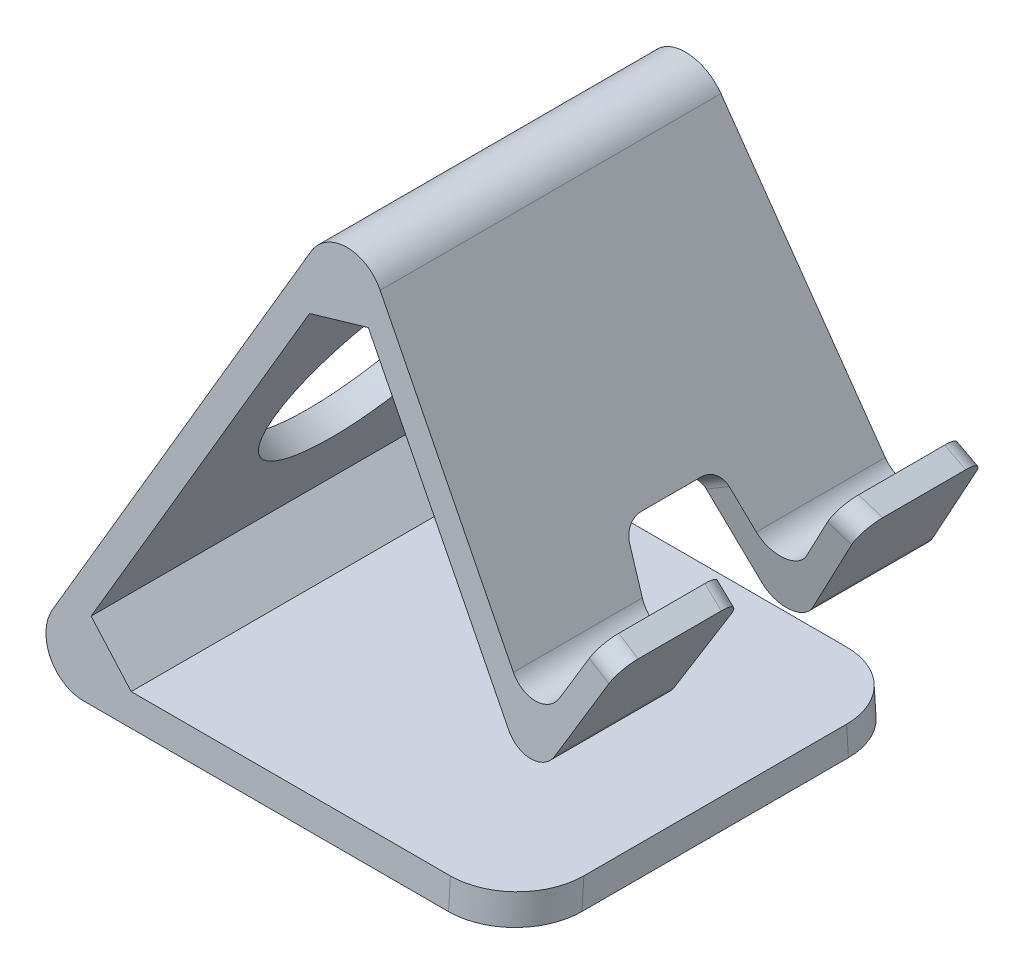
from build123d import *
from OCP.BRepFilletAPI import BRepFilletAPI_MakeChamfer

# Parameters (mm, degrees)
EXTRUDE_1_DEPTH                 = 30
CUT_EXTRUDE_1_DEPTH             = 114.688170009
CUT_EXTRUDE_1_DEPTH_BACK        = 114.688170009
CUT_EXTRUDE_2_REACH             = 87.147
CUT_EXTRUDE_2_DIRECTION_2_DEPTH = 86.146653668
FILLET_1_R                      = 10
CHAMFER_1_SIZE                  = 10
CHAMFER_1_SIZE2                 = 7.328994571
CHAMFER_1_SIZE2_2               = 7.3430239
FILLET_2_R                      = 6
FILLET_3_R                      = 4
FILLET_4_R                      = 3
SKETCH_5_R                      = 5
EXTRUDE_2_DEPTH                 = 1
CUT_EXTRUDE_3_REACH             = 120.862
SKETCH_6_R                      = 17.5
CUT_EXTRUDE_4_DEPTH             = 1
FILLET_5_R                      = 3


with BuildPart() as part:
    # 草图1 → 凸台-拉伸1 (new, symmetric)
    with BuildSketch(Plane.XY):
        Polygon((75, 0), (75, 4.5), (7.120639938, 4.5), (45.106425199, 72.030284909), (75.873796317, 20.597074957), (88.0081468, 41.61438651), (84.977057886, 43.36438651), (76.106425199, 28), (45, 80), (0, 0), align=None)
    extrude(amount=EXTRUDE_1_DEPTH, both=True)

    # 草图2 → 切除-拉伸1 (cut, two sides: drawn at the far end of the back side and taken through both)
    with BuildSketch(Plane(origin=(75, 0, 0), x_dir=(0, 0, -1), z_dir=(1, 0, 0)).offset(-CUT_EXTRUDE_1_DEPTH_BACK)):
        Polygon((-30, 0), (-30, 80), (-25, 80), align=None)
        Polygon((25, 80), (30, 0), (30, 80), align=None)
    extrude(amount=CUT_EXTRUDE_1_DEPTH + CUT_EXTRUDE_1_DEPTH_BACK, mode=Mode.SUBTRACT)

    # 草图4 → 切除-拉伸2 (cut, up to next)
    with BuildSketch(Plane(origin=(68.384918365, 40.907891305, 0), x_dir=(0, 0, -1), z_dir=(0.8581734811109418, 0.5133597922684714, 0)), mode=Mode.PRIVATE) as cut_extrude_2_sk1:
        Polygon((7, 0), (-7, 0), (-12, -26.635610966), (12, -26.635610966), align=None)
    cut_extrude_2_tool1 = extrude(cut_extrude_2_sk1.sketch, amount=-CUT_EXTRUDE_2_REACH, mode=Mode.PRIVATE) & part.part
    add(cut_extrude_2_tool1.solids().sort_by_distance((75.821466, 28.476361, 0))[0], mode=Mode.SUBTRACT)

    # 草图4 → 切除-拉伸2 direction 2 (cut)
    with BuildSketch(Plane(origin=(68.384918365, 40.907891305, 0), x_dir=(0, 0, -1), z_dir=(0.8581734811109418, 0.5133597922684714, 0))):
        Polygon((7, 0), (-7, 0), (-12, -26.635610966), (12, -26.635610966), align=None)
    extrude(amount=CUT_EXTRUDE_2_DIRECTION_2_DEPTH, mode=Mode.SUBTRACT)

    # 圆角1
    fillet_1_edges = [part.edges().sort_by_distance(p)[0] for p in [
        (75, 2.25, 29.859375),
        (75, 2.25, -29.859375),
    ]]
    fillet(fillet_1_edges, radius=FILLET_1_R)

    # 倒角1: one chamfer whose edges measure the first distance from different faces: ONE call of the kernel's chamfer builder (chamfer() names one face for all edges)
    chamfer_1_edges_1 = [part.edges().sort_by_distance(p)[0] for p in [
        (45.106425199, 72.030284909, 0),
    ]]
    chamfer_1_side_1 = [part.faces().sort_by_distance(p)[0] for p in [
        (25.629609, 37.404833889, 0),
    ]]
    chamfer_1_edges_2 = [part.edges().sort_by_distance(p)[0] for p in [
        (7.120639938, 4.5, 0),
    ]]
    chamfer_1_side_2 = [part.faces().sort_by_distance(p)[0] for p in [
        (40.718728401, 4.5, 0),
    ]]
    chamfer_1 = BRepFilletAPI_MakeChamfer(part.part.solid().wrapped)
    for e in chamfer_1_edges_1:
        chamfer_1.Add(CHAMFER_1_SIZE, CHAMFER_1_SIZE2, e.wrapped, chamfer_1_side_1[0].wrapped)  # the first distance lies on this face
    for e in chamfer_1_edges_2:
        chamfer_1.Add(CHAMFER_1_SIZE, CHAMFER_1_SIZE2_2, e.wrapped, chamfer_1_side_2[0].wrapped)  # the first distance lies on this face
    add(Compound.cast(chamfer_1.Shape()), mode=Mode.REPLACE)

    # 圆角2
    fillet_2_edges = [part.edges().sort_by_distance(p)[0] for p in [
        (0, 0, 0),
        (45, 80, 0),
    ]]
    fillet(fillet_2_edges, radius=FILLET_2_R)

    # 圆角3
    fillet_3_edges = [part.edges().sort_by_distance(p)[0] for p in [
        (76.106425199, 28, -19.036749216),
        (75.873796317, 20.597074957, -19.853169341),
        (76.106425199, 28, 19.036749216),
        (75.873796317, 20.597074957, 19.853169341),
    ]]
    fillet(fillet_3_edges, radius=FILLET_3_R)

    # 圆角4
    fillet_4_edges = [part.edges().sort_by_distance(p)[0] for p in [
        (86.492602343, 42.48938651, 8.490215421),
        (86.492602343, 42.48938651, -8.490215421),
        (86.492602343, 42.48938651, 27.344413343),
        (86.492602343, 42.48938651, -27.344413343),
    ]]
    fillet(fillet_4_edges, radius=FILLET_4_R)

    # 草图5 → 凸台-拉伸2 (add, symmetric)
    with BuildSketch(Plane.XZ):
        with Locations(Location((65, 19.980487786, 0), (0, 0, 90))):
            Circle(SKETCH_5_R)
        with Locations(Location((65, -19.980487786, 0), (0, 0, 90))):
            Circle(SKETCH_5_R)
        with BuildLine():
            Line((26.526731338, 10), (26.526731338, -10))
            ThreePointArc((26.526731338, -10), (21.526731338, -15), (16.526731338, -10))
            Line((16.526731338, -10), (16.526731338, 10))
            ThreePointArc((16.526731338, 10), (21.526731338, 15), (26.526731338, 10))
        make_face()
    extrude(amount=EXTRUDE_2_DEPTH, both=True)

    # 草图6 → 切除-拉伸3 (cut, up to next)
    with BuildSketch(Plane(origin=(0, 0, 0), x_dir=(0, 0, 1), z_dir=(-0.8715755371245493, 0.49026123963255896, 0)), mode=Mode.PRIVATE) as cut_extrude_3_sk1:
        with Locations(Location((0, 45.852917409, 0), (0, 0, 270))):
            Circle(SKETCH_6_R)
    cut_extrude_3_tool1 = extrude(cut_extrude_3_sk1.sketch, amount=-CUT_EXTRUDE_3_REACH, mode=Mode.PRIVATE) & part.part
    add(cut_extrude_3_tool1.solids().sort_by_distance((22.479908, 39.964281, 0))[0], mode=Mode.SUBTRACT)

    # 草图7 → 切除-拉伸4 (cut)
    # profile 1 of 10: a face of its own
    with BuildSketch(Plane(origin=(0, 0, 0), x_dir=(0, 0, 1), z_dir=(-0.8715755371245493, 0.49026123963255896, 0))):
        with BuildLine():
            Line((-19.399104661, 19.775119977), (-19.399104661, 18.150683932))
            Line((-19.399104661, 18.150683932), (-19.975517451, 18.150683932))
            Line((-19.975517451, 18.150683932), (-19.975517451, 22.447579277))
            Line((-19.975517451, 22.447579277), (-18.76046549, 22.447579277))
            add(Edge.make_bspline(
                [(-18.76046549, 22.447579277), (-18.704203936, 22.446766241), (-18.594998956, 22.445188118), (-18.435998347, 22.429256883), (-18.286691614, 22.403551023), (-18.147030472, 22.366614071), (-18.016690831, 22.319958484), (-17.895849834, 22.26301983), (-17.785484452, 22.194124399), (-17.684256691, 22.116821146), (-17.594608587, 22.028592131), (-17.516356648, 21.931316221), (-17.449321218, 21.825351703), (-17.39625758, 21.709400996), (-17.354408635, 21.585060226), (-17.324241682, 21.451780839), (-17.305942193, 21.309457), (-17.304036753, 21.211568417), (-17.303058151, 21.161294485)],
                knots=[0, 0, 0, 0, 1.221496758, 2.370953492, 3.466229561, 4.50853695, 5.504092727, 6.469115662, 7.403359976, 8.324520871, 9.229832985, 10.127722387, 11.030547589, 11.94541344, 12.890072117, 13.874984866, 14.908627926, 16, 16, 16, 16], degree=3))
            add(Edge.make_bspline(
                [(-17.303058151, 21.161294485), (-17.304120558, 21.110174875), (-17.306209655, 21.009654281), (-17.328442873, 20.862992252), (-17.36240952, 20.723429523), (-17.411036427, 20.591577203), (-17.473609659, 20.467123931), (-17.550133863, 20.35050613), (-17.640478876, 20.241252227), (-17.743707964, 20.140885771), (-17.857321945, 20.050247341), (-17.978460752, 19.971121857), (-18.107302586, 19.90638456), (-18.242417147, 19.853712521), (-18.384562278, 19.81304358), (-18.534213736, 19.787800271), (-18.690296428, 19.772997412), (-18.796459448, 19.774403721), (-18.850529988, 19.775119977)],
                knots=[0, 0, 0, 0, 1.047567089, 2.059915297, 3.034553849, 3.988992129, 4.935123622, 5.885153844, 6.843260912, 7.836680967, 8.832258631, 9.819590091, 10.798269876, 11.783568742, 12.78991175, 13.824162436, 14.891810808, 16, 16, 16, 16], degree=3))
            Line((-18.850529988, 19.775119977), (-19.399104661, 19.775119977))
        make_face()
        with BuildLine():
            Line((-19.399104661, 21.975968813), (-19.399104661, 20.246730442))
            Line((-19.399104661, 20.246730442), (-18.895562237, 20.246730442))
            add(Edge.make_bspline(
                [(-18.895562237, 20.246730442), (-18.855132758, 20.247141877), (-18.776825856, 20.247938777), (-18.6631213, 20.260278049), (-18.556724388, 20.277387485), (-18.458002942, 20.303203276), (-18.366240149, 20.334562125), (-18.282732286, 20.374909649), (-18.206359526, 20.422014914), (-18.137509708, 20.475932545), (-18.076350352, 20.53687963), (-18.02374363, 20.604808505), (-17.978315729, 20.678384591), (-17.942471937, 20.75902707), (-17.913361405, 20.844951512), (-17.894417897, 20.9376675), (-17.881559748, 21.036207765), (-17.880180436, 21.104209033), (-17.879470941, 21.139187745)],
                knots=[0, 0, 0, 0, 1.257807907, 2.436218341, 3.556349562, 4.609289964, 5.608814519, 6.570169625, 7.489619625, 8.397178748, 9.286258589, 10.169964329, 11.066038699, 11.970929755, 12.911220345, 13.884328166, 14.911733895, 16, 16, 16, 16], degree=3))
            add(Edge.make_bspline(
                [(-17.879470941, 21.139187745), (-17.880366407, 21.17305432), (-17.882104127, 21.238774976), (-17.892340429, 21.333965502), (-17.911136731, 21.422659033), (-17.938465078, 21.504432389), (-17.971597318, 21.580804996), (-18.013959479, 21.649587853), (-18.062411007, 21.71285808), (-18.119236744, 21.768700183), (-18.184210581, 21.817443536), (-18.256259665, 21.859768468), (-18.335734821, 21.896209257), (-18.422812258, 21.92535288), (-18.517335273, 21.94819436), (-18.619184995, 21.964293723), (-18.72860716, 21.974266959), (-18.804110594, 21.975388665), (-18.843161075, 21.975968813)],
                knots=[0, 0, 0, 0, 1.111901111, 2.157728374, 3.138310241, 4.081801531, 4.984240268, 5.864706733, 6.726745576, 7.594723825, 8.470986253, 9.386802377, 10.332970003, 11.335972228, 12.39643462, 13.521791194, 14.718266964, 16, 16, 16, 16], degree=3))
            Line((-18.843161075, 21.975968813), (-19.399104661, 21.975968813))
        make_face(mode=Mode.SUBTRACT)
    # profile 2 of 10: a face of its own
    with BuildSketch(Plane(origin=(0, 0, 0), x_dir=(0, 0, 1), z_dir=(-0.8715755371245493, 0.49026123963255896, 0))):
        Polygon((-13.215767457, 18.150683932), (-13.792180247, 18.150683932), (-13.792180247, 20.089526954), (-15.94062792, 20.089526954), (-15.94062792, 18.150683932), (-16.51704071, 18.150683932), (-16.51704071, 22.447579277), (-15.94062792, 22.447579277), (-15.94062792, 20.561137418), (-13.792180247, 20.561137418), (-13.792180247, 22.447579277), (-13.215767457, 22.447579277), align=None)
    # profile 3 of 10: a face of its own
    with BuildSketch(Plane(origin=(0, 0, 0), x_dir=(0, 0, 1), z_dir=(-0.8715755371245493, 0.49026123963255896, 0))):
        with BuildLine():
            add(Edge.make_bspline(
                [(-12.429750016, 20.248367978), (-12.428039367, 20.332224132), (-12.424704031, 20.495722617), (-12.398187382, 20.734568876), (-12.354154886, 20.960256252), (-12.293186759, 21.173261776), (-12.213488359, 21.372793841), (-12.11530494, 21.558790611), (-12.000681773, 21.732368636), (-11.86839789, 21.891329956), (-11.721713702, 22.034973246), (-11.55984656, 22.158661191), (-11.387139048, 22.265715866), (-11.200874213, 22.351714248), (-11.001998936, 22.418238833), (-10.790977685, 22.465123599), (-10.567606701, 22.494564057), (-10.414582828, 22.498145163), (-10.33615981, 22.49998044)],
                knots=[0, 0, 0, 0, 1.158510879, 2.258805906, 3.315699711, 4.332576337, 5.315797817, 6.279028103, 7.233983928, 8.184730643, 9.131489913, 10.064570513, 10.994016395, 11.933809892, 12.892637502, 13.886219116, 14.916711014, 16, 16, 16, 16], degree=3))
            add(Edge.make_bspline(
                [(-10.33615981, 22.49998044), (-10.262911862, 22.498493374), (-10.119645332, 22.495584803), (-9.910518153, 22.465706859), (-9.712445297, 22.419492616), (-9.524802509, 22.354868203), (-9.348950118, 22.269651187), (-9.183202081, 22.167136441), (-9.029210051, 22.044739227), (-8.887479401, 21.904971113), (-8.759080839, 21.750748931), (-8.647402153, 21.583770318), (-8.552576703, 21.405828482), (-8.475500186, 21.216469637), (-8.415583943, 21.015726154), (-8.37375014, 20.803510192), (-8.346451986, 20.580407711), (-8.343808023, 20.427761151), (-8.342459322, 20.349895231)],
                knots=[0, 0, 0, 0, 1.065070709, 2.083184418, 3.066549119, 4.02094667, 4.96400148, 5.903882633, 6.850841688, 7.819562541, 8.795200571, 9.765450196, 10.737128834, 11.723743066, 12.735050836, 13.780118611, 14.867625272, 16, 16, 16, 16], degree=3))
            add(Edge.make_bspline(
                [(-8.342459322, 20.349895231), (-8.344154055, 20.265761905), (-8.347464073, 20.101439402), (-8.374267317, 19.861623758), (-8.416850382, 19.634874715), (-8.478405454, 19.421511198), (-8.55784676, 19.221793424), (-8.655007993, 19.035526302), (-8.769316447, 18.862340467), (-8.901008014, 18.703827122), (-9.047398412, 18.56148807), (-9.20600935, 18.436886887), (-9.376963681, 18.33206282), (-9.560096965, 18.246799452), (-9.75476524, 18.179259824), (-9.961482992, 18.132082764), (-10.179818826, 18.104005507), (-10.329252412, 18.100220505), (-10.405755105, 18.098282769)],
                knots=[0, 0, 0, 0, 1.170824374, 2.286760772, 3.354429575, 4.378781923, 5.372758946, 6.341306435, 7.298017473, 8.255753746, 9.204101261, 10.135039238, 11.05763034, 11.988955804, 12.941676056, 13.920340457, 14.935315948, 16, 16, 16, 16], degree=3))
            add(Edge.make_bspline(
                [(-10.405755105, 18.098282769), (-10.480376127, 18.099733433), (-10.626377012, 18.102571752), (-10.839370929, 18.132976764), (-11.041821903, 18.177202224), (-11.23209439, 18.244036182), (-11.411998645, 18.326822163), (-11.578623219, 18.43171043), (-11.735827804, 18.552227577), (-11.878949566, 18.692260534), (-12.008041044, 18.84694616), (-12.121900507, 19.013508585), (-12.216875354, 19.192284648), (-12.295156526, 19.381720754), (-12.355654798, 19.582522935), (-12.399016275, 19.794588548), (-12.424378689, 20.01795013), (-12.427935286, 20.170520158), (-12.429750016, 20.248367978)],
                knots=[0, 0, 0, 0, 1.076574679, 2.106388418, 3.10050034, 4.063748489, 5.012109131, 5.953543952, 6.900110232, 7.867026378, 8.837692636, 9.804897769, 10.774443719, 11.754976828, 12.759652806, 13.797478677, 14.876178449, 16, 16, 16, 16], degree=3))
        make_face()
        with BuildLine():
            add(Edge.make_bspline(
                [(-11.853337225, 20.295037764), (-11.852092768, 20.231395088), (-11.849662269, 20.107097186), (-11.830340842, 19.925677642), (-11.800027824, 19.75374943), (-11.754975102, 19.591958543), (-11.700520119, 19.438657907), (-11.629541973, 19.296651115), (-11.548892701, 19.162840036), (-11.454614231, 19.040705457), (-11.351139156, 18.929914316), (-11.238405636, 18.8337049), (-11.118089278, 18.751691531), (-10.989810179, 18.68542752), (-10.854257752, 18.633125458), (-10.711074675, 18.596656731), (-10.560142497, 18.573855564), (-10.456874841, 18.571233031), (-10.404117568, 18.569893234)],
                knots=[0, 0, 0, 0, 1.20602457, 2.355437185, 3.454324103, 4.511001866, 5.535469377, 6.532588819, 7.514714146, 8.492470201, 9.451281297, 10.383258467, 11.295780282, 12.205070569, 13.113889858, 14.043610299, 15.000521651, 16, 16, 16, 16], degree=3))
            add(Edge.make_bspline(
                [(-10.404117568, 18.569893234), (-10.347826274, 18.571302391), (-10.2378292, 18.574055979), (-10.077675562, 18.595685908), (-9.926769538, 18.630773009), (-9.784844937, 18.679847147), (-9.652434978, 18.743970934), (-9.529481664, 18.822469761), (-9.415872784, 18.914597246), (-9.312400946, 19.020739642), (-9.219980039, 19.139876387), (-9.138573365, 19.270253842), (-9.07046548, 19.412364975), (-9.014783003, 19.565431325), (-8.971619461, 19.729915767), (-8.94057712, 19.905682841), (-8.922861831, 20.092710718), (-8.920224592, 20.22103854), (-8.918872112, 20.286850082)],
                knots=[0, 0, 0, 0, 1.050238148, 2.052237813, 3.009712863, 3.937548075, 4.848751615, 5.74879752, 6.654045465, 7.572508576, 8.508832851, 9.462833466, 10.435563278, 11.444259228, 12.49809764, 13.605132832, 14.771818164, 16, 16, 16, 16], degree=3))
            add(Edge.make_bspline(
                [(-8.918872112, 20.286850082), (-8.919755967, 20.354311955), (-8.921477296, 20.485695583), (-8.941065612, 20.676886065), (-8.970914466, 20.856419228), (-9.011937217, 21.02448404), (-9.067423803, 21.179861948), (-9.133292787, 21.324060086), (-9.212506054, 21.456054527), (-9.303367016, 21.575789478), (-9.404804762, 21.682279655), (-9.515793387, 21.775089053), (-9.63559145, 21.854161668), (-9.764929602, 21.918181322), (-9.903182105, 21.96767729), (-10.050116684, 22.002371931), (-10.206138847, 22.024292639), (-10.313159031, 22.026986985), (-10.368091769, 22.028369975)],
                knots=[0, 0, 0, 0, 1.261178879, 2.456176373, 3.589779302, 4.66302718, 5.686490866, 6.670717547, 7.623063715, 8.559146006, 9.476095161, 10.367459636, 11.259291589, 12.154054306, 13.059755282, 13.99935134, 14.973080545, 16, 16, 16, 16], degree=3))
            add(Edge.make_bspline(
                [(-10.368091769, 22.028369975), (-10.422223855, 22.027119591), (-10.528267414, 22.024670115), (-10.682870896, 22.000613981), (-10.82996626, 21.964299631), (-10.969192698, 21.911767781), (-11.099881365, 21.842831686), (-11.223852411, 21.760894133), (-11.338758769, 21.662529876), (-11.444848232, 21.550286283), (-11.54111641, 21.426512948), (-11.624971467, 21.292324367), (-11.695892561, 21.148937103), (-11.752905886, 20.995932544), (-11.797990566, 20.833763765), (-11.830823938, 20.662412675), (-11.849494183, 20.481587786), (-11.852037582, 20.358125409), (-11.853337225, 20.295037764)],
                knots=[0, 0, 0, 0, 1.012527091, 1.983518156, 2.921439044, 3.844608478, 4.760868639, 5.681816309, 6.620460344, 7.585263555, 8.568274607, 9.550555325, 10.542077912, 11.557320507, 12.602180184, 13.689234584, 14.819229379, 16, 16, 16, 16], degree=3))
        make_face(mode=Mode.SUBTRACT)
    # profile 4 of 10: a face of its own
    with BuildSketch(Plane(origin=(0, 0, 0), x_dir=(0, 0, 1), z_dir=(-0.8715755371245493, 0.49026123963255896, 0))):
        with BuildLine():
            Line((-3.993162814, 18.150683932), (-4.676834234, 18.150683932))
            Line((-4.676834234, 18.150683932), (-6.784343498, 21.486345448))
            add(Edge.make_bspline(
                [(-6.784343498, 21.486345448), (-6.812236517, 21.532703424), (-6.866425524, 21.622765121), (-6.907631931, 21.719447608), (-6.927627927, 21.766364162)],
                knots=[0, 0, 0, 0, 1.029471514, 2, 2, 2, 2], degree=3))
            Line((-6.927627927, 21.766364162), (-6.944822059, 21.766364162))
            add(Edge.make_bspline(
                [(-6.944822059, 21.766364162), (-6.943347309, 21.752727174), (-6.940049162, 21.72222926), (-6.937318376, 21.671391663), (-6.933760495, 21.611104316), (-6.931426306, 21.540943287), (-6.930084772, 21.460963991), (-6.928183577, 21.371179572), (-6.927465397, 21.271556307), (-6.927571941, 21.201959941), (-6.927627927, 21.165388326)],
                knots=[0, 0, 0, 0, 0.547243266, 1.223861017, 2.030938069, 2.957211031, 4.024706972, 5.222865249, 6.540666563, 8, 8, 8, 8], degree=3))
            Line((-6.927627927, 21.165388326), (-6.927627927, 18.150683932))
            Line((-6.927627927, 18.150683932), (-7.504040718, 18.150683932))
            Line((-7.504040718, 18.150683932), (-7.504040718, 22.447579277))
            Line((-7.504040718, 22.447579277), (-6.770424439, 22.447579277))
            Line((-6.770424439, 22.447579277), (-4.725960324, 19.179875519))
            add(Edge.make_bspline(
                [(-4.725960324, 19.179875519), (-4.714525608, 19.161299341), (-4.692808881, 19.126019601), (-4.661608186, 19.07629842), (-4.634223464, 19.031590447), (-4.61079959, 18.991984226), (-4.591038858, 18.957649466), (-4.575359045, 18.928632448), (-4.562916766, 18.904958855), (-4.556162032, 18.890597378), (-4.553200241, 18.884300211)],
                knots=[0, 0, 0, 0, 1.528350138, 2.902631225, 4.112788085, 5.201585076, 6.126599139, 6.888137874, 7.512474782, 8, 8, 8, 8], degree=3))
            Line((-4.553200241, 18.884300211), (-4.541737486, 18.884300211))
            add(Edge.make_bspline(
                [(-4.541737486, 18.884300211), (-4.544043307, 18.900661122), (-4.54906686, 18.936305658), (-4.55434236, 18.993965084), (-4.559637465, 19.059988561), (-4.562173081, 19.134028932), (-4.565803573, 19.216151322), (-4.568385371, 19.306223107), (-4.568674549, 19.404492179), (-4.569267349, 19.472722089), (-4.569575604, 19.508201555)],
                knots=[0, 0, 0, 0, 0.634399717, 1.382128569, 2.222929659, 3.177583211, 4.226479155, 5.379771441, 6.637484509, 8, 8, 8, 8], degree=3))
            Line((-4.569575604, 19.508201555), (-4.569575604, 22.447579277))
            Line((-4.569575604, 22.447579277), (-3.993162814, 22.447579277))
            Line((-3.993162814, 22.447579277), (-3.993162814, 18.150683932))
        make_face()
    # profile 5 of 10: a face of its own
    with BuildSketch(Plane(origin=(0, 0, 0), x_dir=(0, 0, 1), z_dir=(-0.8715755371245493, 0.49026123963255896, 0))):
        Polygon((-0.639488398, 18.150683932), (-2.945139559, 18.150683932), (-2.945139559, 22.447579277), (-0.744290724, 22.447579277), (-0.744290724, 21.975968813), (-2.368726769, 21.975968813), (-2.368726769, 20.561137418), (-0.849093049, 20.561137418), (-0.849093049, 20.089526954), (-2.368726769, 20.089526954), (-2.368726769, 18.622294397), (-0.639488398, 18.622294397), align=None)
    # profile 6 of 10: a face of its own
    with BuildSketch(Plane(origin=(0, 0, 0), x_dir=(0, 0, 1), z_dir=(-0.8715755371245493, 0.49026123963255896, 0))):
        with BuildLine():
            add(Edge.make_bspline(
                [(1.666162763, 18.949801664), (1.701074457, 18.922511731), (1.77323226, 18.86610709), (1.897093387, 18.794476642), (2.036742904, 18.730052923), (2.189694068, 18.674250891), (2.348328669, 18.628176167), (2.506628999, 18.59565402), (2.660347413, 18.573637046), (2.761876159, 18.571124324), (2.81161943, 18.569893234)],
                knots=[0, 0, 0, 0, 0.865539583, 1.788954577, 2.789281186, 3.869785964, 4.969270071, 6.015824901, 7.027867855, 8, 8, 8, 8], degree=3))
            add(Edge.make_bspline(
                [(2.81161943, 18.569893234), (2.847928003, 18.570357607), (2.918168595, 18.571255957), (3.020207572, 18.578352404), (3.114973385, 18.591722039), (3.202894178, 18.608493833), (3.283862162, 18.6304015), (3.357747907, 18.658398168), (3.425144667, 18.69088262), (3.485451723, 18.728601055), (3.53836402, 18.771653813), (3.584654773, 18.819196698), (3.623507216, 18.872092814), (3.654958031, 18.930303723), (3.679181707, 18.993425466), (3.697567621, 19.06137814), (3.708210121, 19.134504756), (3.709265673, 19.185026261), (3.70980811, 19.21098871)],
                knots=[0, 0, 0, 0, 1.387952524, 2.685057481, 3.906752822, 5.044389127, 6.104925896, 7.10867273, 8.060544729, 8.960756871, 9.821090645, 10.662232403, 11.49066096, 12.321647717, 13.183814073, 14.069581906, 15.007979264, 16, 16, 16, 16], degree=3))
            add(Edge.make_bspline(
                [(3.70980811, 19.21098871), (3.708827838, 19.240293384), (3.706902586, 19.297847705), (3.688014227, 19.381763187), (3.657820532, 19.461203421), (3.614147475, 19.53506718), (3.561218366, 19.605203822), (3.499000748, 19.67115321), (3.427811573, 19.733268657), (3.360381521, 19.780871106), (3.298520829, 19.819511395), (3.242883947, 19.853375807), (3.17754975, 19.88959408), (3.10336252, 19.930079582), (3.019795166, 19.974207941), (2.926977097, 20.022201189), (2.824903174, 20.07406212), (2.753785057, 20.109500642), (2.716642322, 20.128009058)],
                knots=[0, 0, 0, 0, 0.982941607, 1.930495303, 2.873604538, 3.826420128, 4.801766699, 5.819939166, 6.86595615, 7.96993426, 8.587927195, 9.315806065, 10.157204154, 11.096563792, 12.154522406, 13.331194997, 14.606167838, 16, 16, 16, 16], degree=3))
            add(Edge.make_bspline(
                [(2.716642322, 20.128009058), (2.665160181, 20.154153506), (2.566073096, 20.204473426), (2.425972026, 20.282299411), (2.299664012, 20.358282104), (2.186791229, 20.432722444), (2.087742452, 20.506452241), (2.001306739, 20.577739649), (1.929525084, 20.648655147), (1.86979805, 20.718201644), (1.822050243, 20.789704014), (1.779594877, 20.861759374), (1.744760333, 20.937066398), (1.715764725, 21.014456915), (1.693551044, 21.094182542), (1.678351803, 21.176409298), (1.667930608, 21.260919326), (1.666756482, 21.318193191), (1.666162763, 21.34715486)],
                knots=[0, 0, 0, 0, 1.619222821, 3.116499544, 4.493497657, 5.752362701, 6.906613858, 7.955228956, 8.891569654, 9.733419001, 10.521050387, 11.299554277, 12.076853168, 12.844596608, 13.615272338, 14.394378029, 15.188085306, 16, 16, 16, 16], degree=3))
            add(Edge.make_bspline(
                [(1.666162763, 21.34715486), (1.667269368, 21.390368614), (1.669432778, 21.474851359), (1.690831381, 21.597889075), (1.724056736, 21.714403045), (1.771929232, 21.823851351), (1.833207543, 21.926296735), (1.907598977, 22.022057834), (1.995762019, 22.110951459), (2.097414007, 22.1910002), (2.208293819, 22.263823259), (2.327627502, 22.326505192), (2.453139052, 22.381397937), (2.586466952, 22.42395282), (2.726042072, 22.459156185), (2.873259674, 22.481931419), (3.027171626, 22.497377214), (3.132263411, 22.499101898), (3.185796482, 22.49998044)],
                knots=[0, 0, 0, 0, 0.970444009, 1.897214754, 2.797959901, 3.688009903, 4.573800912, 5.474420727, 6.406999593, 7.380328003, 8.377337185, 9.384428898, 10.406559165, 11.452128656, 12.526295673, 13.638633029, 14.797135032, 16, 16, 16, 16], degree=3))
            add(Edge.make_bspline(
                [(3.185796482, 22.49998044), (3.237659414, 22.499781618), (3.337599116, 22.499398487), (3.482279918, 22.49324214), (3.616420959, 22.484859129), (3.73981915, 22.471579004), (3.852536881, 22.455820873), (3.954311184, 22.434909112), (4.046156926, 22.41247297), (4.102419745, 22.391834464), (4.129017412, 22.382077824)],
                knots=[0, 0, 0, 0, 1.302853371, 2.510594277, 3.637626783, 4.678791113, 5.628121996, 6.495466126, 7.288747155, 8, 8, 8, 8], degree=3))
            Line((4.129017412, 22.382077824), (4.129017412, 21.753263871))
            add(Edge.make_bspline(
                [(4.129017412, 21.753263871), (4.095875707, 21.775542927), (4.029070665, 21.820451699), (3.920239505, 21.875086162), (3.80616652, 21.923325944), (3.685124407, 21.961366904), (3.557981338, 21.992004917), (3.424314908, 22.012611409), (3.284339704, 22.026430807), (3.188833902, 22.027713419), (3.139945465, 22.028369975)],
                knots=[0, 0, 0, 0, 0.918063685, 1.850577229, 2.796465716, 3.76568756, 4.766461771, 5.803068333, 6.875413303, 8, 8, 8, 8], degree=3))
            add(Edge.make_bspline(
                [(3.139945465, 22.028369975), (3.107716526, 22.028023238), (3.044513673, 22.027343266), (2.95194792, 22.018331788), (2.863705352, 22.006952622), (2.780214453, 21.988713591), (2.701505517, 21.964821354), (2.626919464, 21.936396913), (2.557083907, 21.902701106), (2.492318691, 21.864601568), (2.434118385, 21.821225028), (2.382886416, 21.77355746), (2.339365663, 21.721936338), (2.303179695, 21.666371946), (2.276617675, 21.606156587), (2.256332098, 21.542304324), (2.245095993, 21.474185405), (2.243425358, 21.427431991), (2.242575553, 21.403649863)],
                knots=[0, 0, 0, 0, 1.262873919, 2.476570353, 3.643139105, 4.749062229, 5.821993494, 6.865119038, 7.874788035, 8.858269162, 9.806190946, 10.714523887, 11.595346505, 12.447099743, 13.304211657, 14.16711336, 15.067662888, 16, 16, 16, 16], degree=3))
            add(Edge.make_bspline(
                [(2.242575553, 21.403649863), (2.242936062, 21.382328453), (2.243641446, 21.340610259), (2.252454268, 21.279579156), (2.264921451, 21.221505062), (2.284162004, 21.166633327), (2.309017052, 21.115017342), (2.338110731, 21.065841621), (2.373259134, 21.020204382), (2.41446737, 20.976363213), (2.465564989, 20.933061662), (2.527249587, 20.886622845), (2.600778597, 20.835542216), (2.688439022, 20.783219539), (2.78696471, 20.724661742), (2.898790203, 20.663759311), (3.022330486, 20.597788763), (3.109803436, 20.55435364), (3.15550206, 20.531661764)],
                knots=[0, 0, 0, 0, 0.763187322, 1.493278232, 2.204869393, 2.8882267, 3.570463978, 4.254590241, 4.931199563, 5.629775194, 6.406064603, 7.327097772, 8.395636964, 9.611359167, 10.983030847, 12.501525311, 14.172286663, 16, 16, 16, 16], degree=3))
            add(Edge.make_bspline(
                [(3.15550206, 20.531661764), (3.206226356, 20.507282093), (3.304507997, 20.460044884), (3.443403134, 20.383989032), (3.571932732, 20.310078498), (3.687681372, 20.234659709), (3.792661868, 20.160623447), (3.884137976, 20.084866706), (3.965468765, 20.010577013), (4.034594672, 19.93458801), (4.094489065, 19.857766595), (4.145042105, 19.778774265), (4.189400985, 19.698244593), (4.224058819, 19.614518457), (4.252511381, 19.529023619), (4.272064783, 19.440969202), (4.283712504, 19.350493702), (4.285379254, 19.289351693), (4.2862209, 19.258477263)],
                knots=[0, 0, 0, 0, 1.495451289, 2.897534645, 4.207528201, 5.434805374, 6.568069241, 7.619400329, 8.589444755, 9.493079686, 10.346190292, 11.175121977, 11.98325998, 12.786172757, 13.579825473, 14.375232997, 15.179553389, 16, 16, 16, 16], degree=3))
            add(Edge.make_bspline(
                [(4.2862209, 19.258477263), (4.284934374, 19.213111356), (4.282419512, 19.124431439), (4.263671394, 18.995520361), (4.231480543, 18.875027167), (4.187323479, 18.762130582), (4.128771745, 18.658241617), (4.058280721, 18.561915618), (3.975316827, 18.473702735), (3.878593848, 18.395689479), (3.772113881, 18.324620359), (3.654343654, 18.264739073), (3.527549027, 18.212323215), (3.390344077, 18.171737456), (3.244050776, 18.137135673), (3.087249906, 18.115394639), (2.920785053, 18.101032117), (2.806466866, 18.099215662), (2.747755512, 18.098282769)],
                knots=[0, 0, 0, 0, 0.998720149, 1.952268215, 2.860405487, 3.739753107, 4.61411738, 5.478324305, 6.362545509, 7.272033822, 8.208731329, 9.176321298, 10.176215934, 11.225542546, 12.323227065, 13.483292636, 14.707473419, 16, 16, 16, 16], degree=3))
            add(Edge.make_bspline(
                [(2.747755512, 18.098282769), (2.703788174, 18.099125505), (2.612150083, 18.10088196), (2.469864962, 18.114220023), (2.316862638, 18.133768768), (2.159059734, 18.161036879), (2.006492744, 18.191971475), (1.872448544, 18.231199199), (1.759025869, 18.269581197), (1.69526369, 18.304878222), (1.666162763, 18.320987711)],
                knots=[0, 0, 0, 0, 0.94778004, 1.975392569, 3.078888875, 4.272571661, 5.427769523, 6.431590237, 7.284181021, 8, 8, 8, 8], degree=3))
            Line((1.666162763, 18.320987711), (1.666162763, 18.949801664))
        make_face()
    # profile 7 of 10: a face of its own
    with BuildSketch(Plane(origin=(0, 0, 0), x_dir=(0, 0, 1), z_dir=(-0.8715755371245493, 0.49026123963255896, 0))):
        Polygon((7.744697641, 21.975968813), (6.487069735, 21.975968813), (6.487069735, 18.150683932), (5.910656945, 18.150683932), (5.910656945, 21.975968813), (4.705430202, 21.975968813), (4.705430202, 22.447579277), (7.744697641, 22.447579277), align=None)
    # profile 8 of 10: a face of its own
    with BuildSketch(Plane(origin=(0, 0, 0), x_dir=(0, 0, 1), z_dir=(-0.8715755371245493, 0.49026123963255896, 0))):
        Polygon((11.72718601, 18.150683932), (11.098372057, 18.150683932), (10.66360616, 19.355910675), (8.888516772, 19.355910675), (8.478313919, 18.150683932), (7.849499966, 18.150683932), (9.473936012, 22.447579277), (10.050348802, 22.447579277), align=None)
        with BuildLine():
            Line((10.470376872, 19.82752114), (9.823550019, 21.622260964))
            add(Edge.make_bspline(
                [(9.823550019, 21.622260964), (9.818187902, 21.639404865), (9.805947908, 21.678538889), (9.789908422, 21.746082043), (9.774182714, 21.829586412), (9.763188285, 21.890535808), (9.757229798, 21.92356765)],
                knots=[0, 0, 0, 0, 0.697926861, 1.593143037, 2.69559139, 4, 4, 4, 4], degree=3))
            Line((9.757229798, 21.92356765), (9.743310739, 21.92356765))
            add(Edge.make_bspline(
                [(9.743310739, 21.92356765), (9.738300204, 21.892969921), (9.728834889, 21.835168267), (9.712856934, 21.754176184), (9.695067183, 21.68418057), (9.681028643, 21.641845689), (9.674534213, 21.622260964)],
                knots=[0, 0, 0, 0, 1.202164453, 2.270988586, 3.200134455, 4, 4, 4, 4], degree=3))
            Line((9.674534213, 21.622260964), (9.033438737, 19.82752114))
            Line((9.033438737, 19.82752114), (10.470376872, 19.82752114))
        make_face(mode=Mode.SUBTRACT)
    # profile 9 of 10: a face of its own
    with BuildSketch(Plane(origin=(0, 0, 0), x_dir=(0, 0, 1), z_dir=(-0.8715755371245493, 0.49026123963255896, 0))):
        with BuildLine():
            Line((15.866877866, 18.150683932), (15.183206446, 18.150683932))
            Line((15.183206446, 18.150683932), (13.075697182, 21.486345448))
            add(Edge.make_bspline(
                [(13.075697182, 21.486345448), (13.047804163, 21.532703424), (12.993615157, 21.622765121), (12.952408749, 21.719447608), (12.932412753, 21.766364162)],
                knots=[0, 0, 0, 0, 1.029471514, 2, 2, 2, 2], degree=3))
            Line((12.932412753, 21.766364162), (12.915218621, 21.766364162))
            add(Edge.make_bspline(
                [(12.915218621, 21.766364162), (12.916693371, 21.752727174), (12.919991519, 21.72222926), (12.922722304, 21.671391663), (12.926280185, 21.611104316), (12.928614374, 21.540943287), (12.929955908, 21.460963991), (12.931857103, 21.371179572), (12.932575283, 21.271556307), (12.93246874, 21.201959941), (12.932412753, 21.165388326)],
                knots=[0, 0, 0, 0, 0.547243266, 1.223861017, 2.030938069, 2.957211031, 4.024706972, 5.222865249, 6.540666563, 8, 8, 8, 8], degree=3))
            Line((12.932412753, 21.165388326), (12.932412753, 18.150683932))
            Line((12.932412753, 18.150683932), (12.355999963, 18.150683932))
            Line((12.355999963, 18.150683932), (12.355999963, 22.447579277))
            Line((12.355999963, 22.447579277), (13.089616241, 22.447579277))
            Line((13.089616241, 22.447579277), (15.134080356, 19.179875519))
            add(Edge.make_bspline(
                [(15.134080356, 19.179875519), (15.145515072, 19.161299341), (15.1672318, 19.126019601), (15.198432494, 19.07629842), (15.225817216, 19.031590447), (15.24924109, 18.991984226), (15.269001822, 18.957649466), (15.284681635, 18.928632448), (15.297123914, 18.904958855), (15.303878649, 18.890597378), (15.30684044, 18.884300211)],
                knots=[0, 0, 0, 0, 1.528350138, 2.902631225, 4.112788085, 5.201585076, 6.126599139, 6.888137874, 7.512474782, 8, 8, 8, 8], degree=3))
            Line((15.30684044, 18.884300211), (15.318303194, 18.884300211))
            add(Edge.make_bspline(
                [(15.318303194, 18.884300211), (15.315997373, 18.900661122), (15.31097382, 18.936305658), (15.30569832, 18.993965084), (15.300403215, 19.059988561), (15.297867599, 19.134028932), (15.294237108, 19.216151322), (15.291655309, 19.306223107), (15.291366131, 19.404492179), (15.290773331, 19.472722089), (15.290465076, 19.508201555)],
                knots=[0, 0, 0, 0, 0.634399717, 1.382128569, 2.222929659, 3.177583211, 4.226479155, 5.379771441, 6.637484509, 8, 8, 8, 8], degree=3))
            Line((15.290465076, 19.508201555), (15.290465076, 22.447579277))
            Line((15.290465076, 22.447579277), (15.866877866, 22.447579277))
            Line((15.866877866, 22.447579277), (15.866877866, 18.150683932))
        make_face()
    # profile 10 of 10: a face of its own
    with BuildSketch(Plane(origin=(0, 0, 0), x_dir=(0, 0, 1), z_dir=(-0.8715755371245493, 0.49026123963255896, 0))):
        with BuildLine():
            Line((16.967302284, 18.150683932), (16.967302284, 22.447579277))
            Line((16.967302284, 22.447579277), (18.179897941, 22.447579277))
            add(Edge.make_bspline(
                [(18.179897941, 22.447579277), (18.258839918, 22.445819733), (18.413622964, 22.442369761), (18.640602783, 22.416163189), (18.857148446, 22.370686268), (19.06385544, 22.30864555), (19.260963199, 22.229389209), (19.446614807, 22.130102173), (19.62284726, 22.01423515), (19.787367273, 21.881536846), (19.93732151, 21.73398939), (20.06804218, 21.572620887), (20.179959375, 21.399589618), (20.270023266, 21.213527442), (20.339955188, 21.015436861), (20.389476108, 20.805461516), (20.420710016, 20.583363585), (20.424063843, 20.431059982), (20.425779025, 20.353170304)],
                knots=[0, 0, 0, 0, 1.098098859, 2.153063457, 3.173250464, 4.172636266, 5.151986424, 6.123547944, 7.096599585, 8.082134872, 9.059421996, 10.017693834, 10.965589155, 11.919933926, 12.886653469, 13.882180262, 14.916924517, 16, 16, 16, 16], degree=3))
            add(Edge.make_bspline(
                [(20.425779025, 20.353170304), (20.42404365, 20.27201233), (20.420641989, 20.112927453), (20.389550605, 19.880756765), (20.339918473, 19.660768473), (20.270249635, 19.453087554), (20.180048838, 19.257863806), (20.068213287, 19.075810465), (19.937757179, 18.905539434), (19.787786724, 18.749383565), (19.62193021, 18.60962462), (19.444576558, 18.485329135), (19.254201848, 18.382056153), (19.052432067, 18.297677213), (18.839620111, 18.230685379), (18.614843682, 18.185073927), (18.379124337, 18.155088393), (18.217930117, 18.15217197), (18.13568446, 18.150683932)],
                knots=[0, 0, 0, 0, 1.089099134, 2.134838925, 3.138336541, 4.112777479, 5.070122611, 6.018995339, 6.975365366, 7.94456379, 8.919445496, 9.882989815, 10.847098251, 11.820884557, 12.815189388, 13.83703468, 14.896396497, 16, 16, 16, 16], degree=3))
            Line((18.13568446, 18.150683932), (16.967302284, 18.150683932))
        make_face()
        with BuildLine():
            Line((17.543715074, 21.975968813), (17.543715074, 18.622294397))
            Line((17.543715074, 18.622294397), (18.153697359, 18.622294397))
            add(Edge.make_bspline(
                [(18.153697359, 18.622294397), (18.218441125, 18.623693934), (18.344743772, 18.626424162), (18.528807973, 18.648105443), (18.702045323, 18.682921444), (18.864478763, 18.731693333), (19.015404578, 18.79634279), (19.1560403, 18.873925807), (19.285419956, 18.966248124), (19.403019084, 19.072274277), (19.507840746, 19.191476302), (19.600320099, 19.321989528), (19.677155077, 19.464729364), (19.740781313, 19.618280162), (19.789400765, 19.783318585), (19.824645092, 19.959183478), (19.845001926, 20.146362421), (19.847883308, 20.27479161), (19.849366235, 20.340888781)],
                knots=[0, 0, 0, 0, 1.133225161, 2.210704532, 3.239605305, 4.223580071, 5.17408513, 6.108761963, 7.030241192, 7.950443593, 8.874594714, 9.803870056, 10.744621382, 11.706491553, 12.708764986, 13.75171528, 14.842901207, 16, 16, 16, 16], degree=3))
            add(Edge.make_bspline(
                [(19.849366235, 20.340888781), (19.847957796, 20.406721021), (19.845220795, 20.534651965), (19.823924461, 20.720196237), (19.788234513, 20.893305153), (19.737493289, 21.053573964), (19.672728204, 21.201620657), (19.59297855, 21.336597005), (19.498862504, 21.459164727), (19.390393618, 21.567917311), (19.27023513, 21.663526527), (19.141341184, 21.747667344), (19.002593662, 21.818315352), (18.855079389, 21.876370387), (18.698299115, 21.921670637), (18.532733833, 21.953113602), (18.358020604, 21.972253133), (18.238626316, 21.974709847), (18.177441636, 21.975968813)],
                knots=[0, 0, 0, 0, 1.188860743, 2.310297766, 3.367991938, 4.376681704, 5.341195913, 6.280474759, 7.201399274, 8.125129785, 9.047438604, 9.970379557, 10.900755085, 11.854615971, 12.829692035, 13.843859804, 14.895066513, 16, 16, 16, 16], degree=3))
            Line((18.177441636, 21.975968813), (17.543715074, 21.975968813))
        make_face(mode=Mode.SUBTRACT)
    extrude(amount=-CUT_EXTRUDE_4_DEPTH, mode=Mode.SUBTRACT)

    # 圆角5
    fillet_5_edges = [part.edges().sort_by_distance(p)[0] for p in [
        (66.668571403, 39.881171721, 7),
        (66.668571403, 39.881171721, -7),
    ]]
    fillet(fillet_5_edges, radius=FILLET_5_R)


solid = part.part
